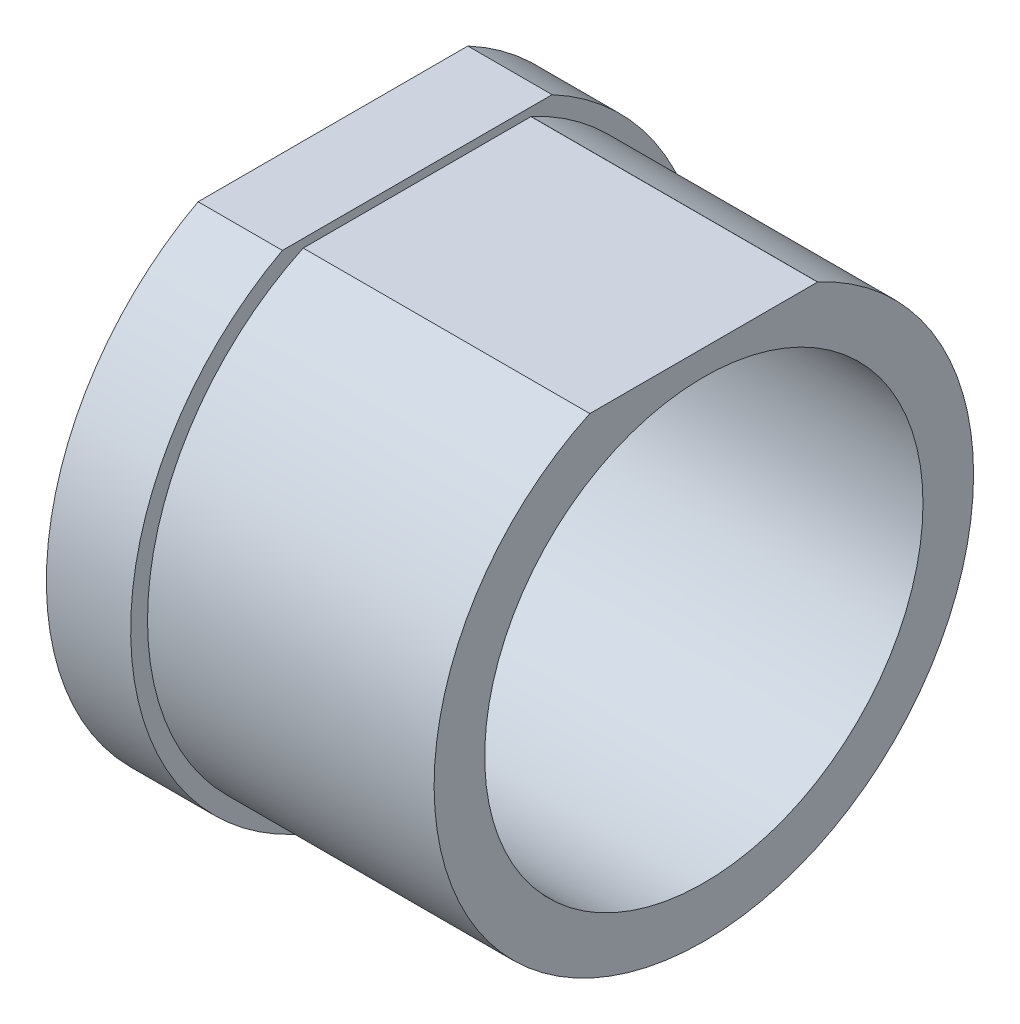
from build123d import *

# Parameters (mm, degrees)
SKETCH1_R           = 34
BOSS_EXTRUDE1_DEPTH = 10
SKETCH2_R           = 32
BOSS_EXTRUDE2_DEPTH = 34
SKETCH3_R           = 26
CUT_EXTRUDE1_DEPTH  = 66.176682947
SKETCH4_W           = 27.053672336
SKETCH4_H           = 7.688048191
CUT_EXTRUDE2_DEPTH  = 34
CUT_EXTRUDE3_REACH  = 67.177
SKETCH5_W           = 49.442103022
SKETCH5_H           = 7.290390526


with BuildPart() as part:
    # Sketch1 → Boss-Extrude1 (new body)
    with BuildSketch(Plane(origin=(0, 0, 0), x_dir=(0, 0, -1), z_dir=(1, 0, 0))):
        Circle(SKETCH1_R)
    extrude(amount=BOSS_EXTRUDE1_DEPTH)

    # Sketch2 → Boss-Extrude2 (add)
    with BuildSketch(Plane(origin=(10, 0, 0), x_dir=(0, 0, -1), z_dir=(1, 0, 0))):
        Circle(SKETCH2_R)
    extrude(amount=BOSS_EXTRUDE2_DEPTH)

    # Sketch3 → Cut-Extrude1 (cut, through all)
    with BuildSketch(Plane(origin=(44, 0, 0), x_dir=(0, 0, -1), z_dir=(1, 0, 0))):
        Circle(SKETCH3_R)
    extrude(amount=-CUT_EXTRUDE1_DEPTH, mode=Mode.SUBTRACT)

    # Sketch4 → Cut-Extrude2 (cut)
    with BuildSketch(Plane(origin=(44, 0, 0), x_dir=(0, 0, -1), z_dir=(1, 0, 0))):
        with Locations((-0.035028199, 32.844024096)):
            Rectangle(SKETCH4_W, SKETCH4_H)
    extrude(amount=-CUT_EXTRUDE2_DEPTH, mode=Mode.SUBTRACT)

    # Sketch5 → Cut-Extrude3 (cut, up to next)
    with BuildSketch(Plane.ZY, mode=Mode.PRIVATE) as cut_extrude3_sk1:
        with Locations((1.06042044, 33.645195263)):
            Rectangle(SKETCH5_W, SKETCH5_H)
    cut_extrude3_tool1 = extrude(cut_extrude3_sk1.sketch, amount=-CUT_EXTRUDE3_REACH, mode=Mode.PRIVATE) & part.part
    add(cut_extrude3_tool1.solids().sort_by_distance((0, 33.645195, 1.06042))[0], mode=Mode.SUBTRACT)


solid = part.part
